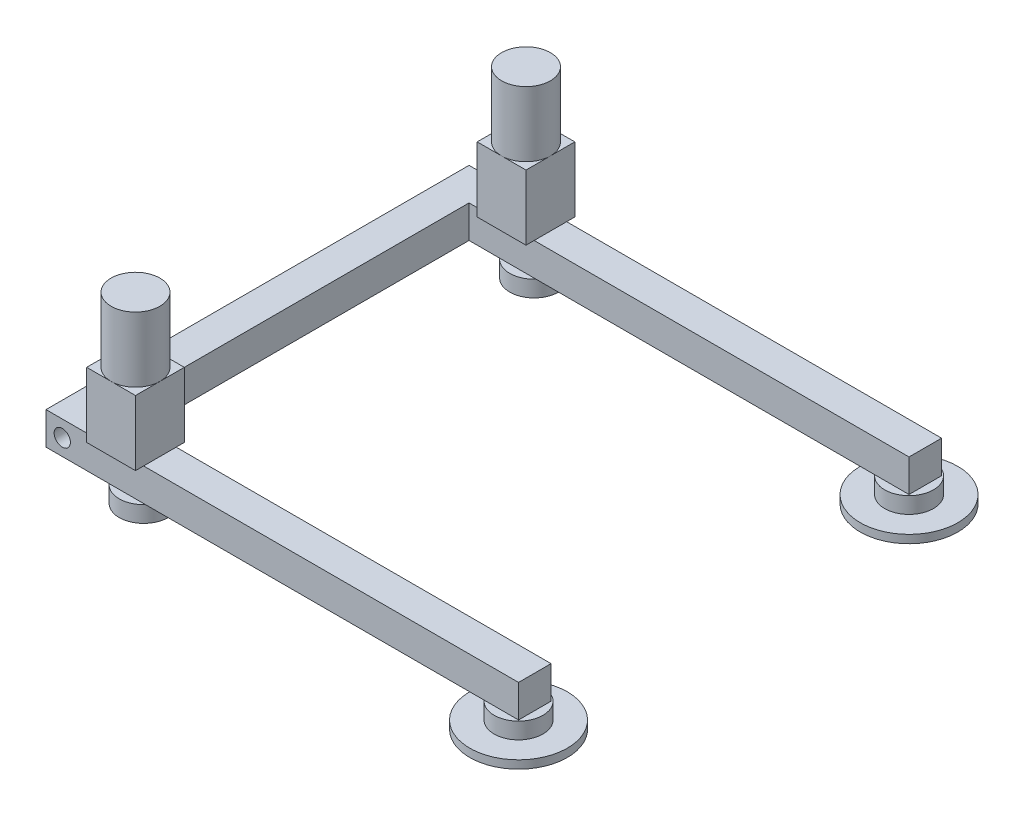
from build123d import *

# Parameters (mm, degrees)
BOSS_EXTRUDE1_DEPTH     = 25.4
SKETCH3_W               = 38.1
SKETCH3_H               = 38.1
BOSS_EXTRUDE2_DEPTH     = 50.8
SKETCH4_R               = 19.05
BOSS_EXTRUDE3_DEPTH     = 50.8
LPATTERN1_COUNT         = 2
LPATTERN1_PITCH         = 304.8
SKETCH5_R               = 19.05
BOSS_EXTRUDE4_DEPTH     = 12.7
SKETCH6_R               = 6.35
BOSS_EXTRUDE5_DEPTH     = 6.35
LPATTERN2_COUNT         = 2
LPATTERN2_PITCH         = 304.8
SKETCH7_R               = 19.05
BOSS_EXTRUDE6_DEPTH     = 12.7
SKETCH8_R               = 38.1
BOSS_EXTRUDE7_DEPTH     = 6.35
LPATTERN3_COUNT         = 2
LPATTERN3_PITCH         = 304.8
CUT_EXTRUDE1_DEPTH      = 546.889568885
CUT_EXTRUDE1_DEPTH_BACK = 546.889568885
SKETCH9_R               = 6.35


with BuildPart() as part:
    # Sketch1 → Boss-Extrude1 (new body)
    with BuildSketch(Plane(origin=(0, 0, 0), x_dir=(1, 0, 0), z_dir=(0, 1, 0))):
        Polygon((0, 0), (0, 166.346037736), (368.827169811, 166.346037736), (368.827169811, 140.946037736), (25.4, 140.946037736), (25.4, -138.453962264), (368.827169811, -138.453962264), (368.827169811, -163.853962264), (0, -163.853962264), align=None)
    extrude(amount=BOSS_EXTRUDE1_DEPTH)

    # Sketch3 → Boss-Extrude2 (add)
    with BuildSketch(Plane(origin=(0, 25.4, 0), x_dir=(1, 0, 0), z_dir=(0, 1, 0))):
        with Locations((57.15, -151.153962264)):
            Rectangle(SKETCH3_W, SKETCH3_H)
    boss_extrude2 = extrude(amount=BOSS_EXTRUDE2_DEPTH)

    # Sketch4 → Boss-Extrude3 (add)
    with BuildSketch(Plane(origin=(0, 76.2, 0), x_dir=(1, 0, 0), z_dir=(0, 1, 0))):
        with Locations(Location((57.15, -151.153962264, 0), (0, 0, 270))):
            Circle(SKETCH4_R)
    boss_extrude3 = extrude(amount=BOSS_EXTRUDE3_DEPTH)

    # LPattern1: Boss-Extrude2, Boss-Extrude3 ×2
    with Locations(*[(0, 0, -i * LPATTERN1_PITCH) for i in range(1, LPATTERN1_COUNT)]):
        add(boss_extrude2)
        add(boss_extrude3)

    # Sketch5 → Boss-Extrude4 (add)
    with BuildSketch(Plane.XZ):
        with Locations(Location((63.5, 151.153962264, 0), (0, 0, 41.810314896))):
            Circle(SKETCH5_R)
    boss_extrude4 = extrude(amount=BOSS_EXTRUDE4_DEPTH)

    # Sketch6 → Boss-Extrude5 (add)
    with BuildSketch(Plane.XZ.offset(12.7)):
        with Locations(Location((63.5, 151.153962264, 0), (0, 0, 270))):
            Circle(SKETCH6_R)
    boss_extrude5 = extrude(amount=BOSS_EXTRUDE5_DEPTH)

    # LPattern2: Boss-Extrude4, Boss-Extrude5 ×2
    with Locations(*[(0, 0, -i * LPATTERN2_PITCH) for i in range(1, LPATTERN2_COUNT)]):
        add(boss_extrude4)
        add(boss_extrude5)

    # Sketch7 → Boss-Extrude6 (add)
    with BuildSketch(Plane.XZ):
        with Locations(Location((356.127169811, 151.153962264, 0), (0, 0, 138.189685104))):
            Circle(SKETCH7_R)
    boss_extrude6 = extrude(amount=BOSS_EXTRUDE6_DEPTH)

    # Sketch8 → Boss-Extrude7 (add)
    with BuildSketch(Plane.XZ.offset(12.7)):
        with Locations(Location((356.127169811, 151.153962264, 0), (0, 0, 270))):
            Circle(SKETCH8_R)
    boss_extrude7 = extrude(amount=BOSS_EXTRUDE7_DEPTH)

    # LPattern3: Boss-Extrude6, Boss-Extrude7 ×2
    with Locations(*[(0, 0, -i * LPATTERN3_PITCH) for i in range(1, LPATTERN3_COUNT)]):
        add(boss_extrude6)
        add(boss_extrude7)

    # Sketch9 → Cut-Extrude1 (cut, two sides: drawn at the far end of the back side and taken through both)
    with BuildSketch(Plane.XY.offset(163.853962264).offset(-CUT_EXTRUDE1_DEPTH_BACK)):
        with Locations(Location((12.7, 12.7, 0), (0, 0, 180))):
            Circle(SKETCH9_R)
    extrude(amount=CUT_EXTRUDE1_DEPTH + CUT_EXTRUDE1_DEPTH_BACK, mode=Mode.SUBTRACT)


solid = part.part
